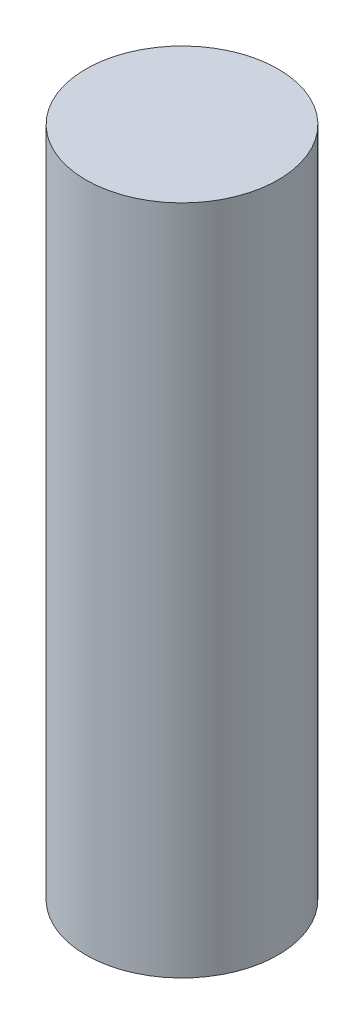
from build123d import *

# Parameters (mm, degrees)
ESQUISSE1_R        = 3.15
BOSS_EXTRU_1_DEPTH = 22


with BuildPart() as part:
    # Esquisse1 → Boss.-Extru.1 (new body)
    with BuildSketch(Plane(origin=(0, 0, 0), x_dir=(1, 0, 0), z_dir=(0, 1, 0))):
        with Locations(Location((0, 0, 0), (0, 0, 270))):
            Circle(ESQUISSE1_R)
    extrude(amount=BOSS_EXTRU_1_DEPTH)


solid = part.part
